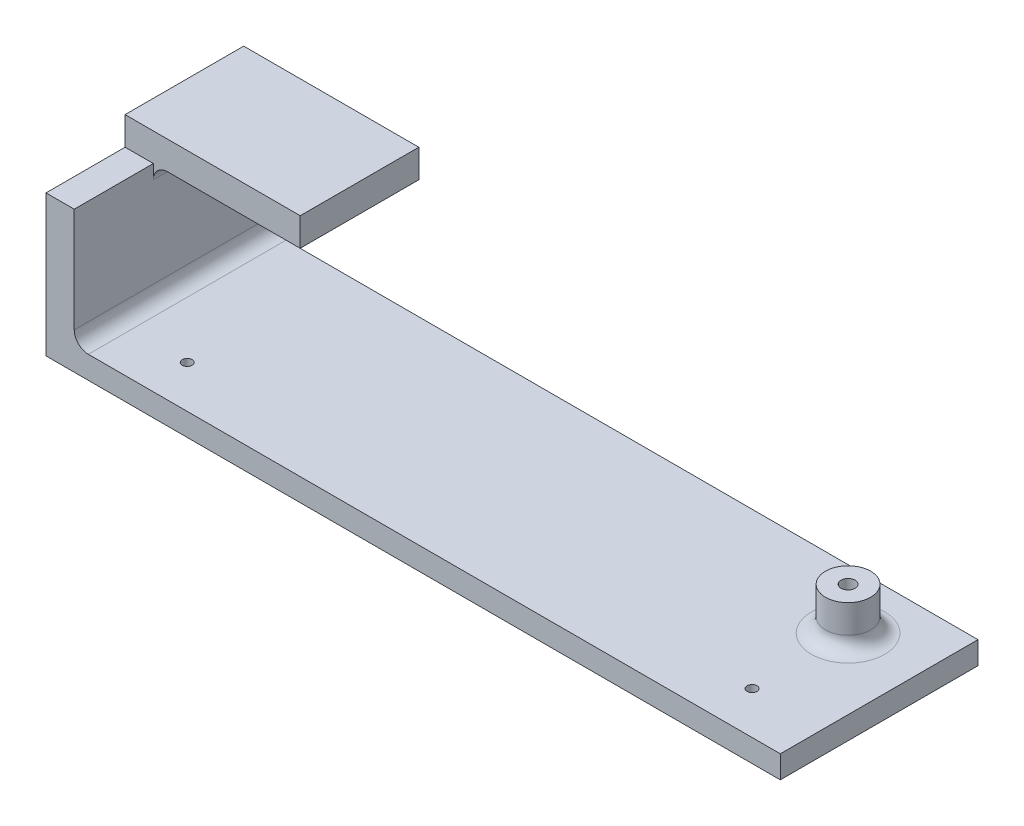
from build123d import *

# Parameters (mm, degrees)
SKETCH_1_W          = 250
SKETCH_1_H          = 70
EXTRUDE_1_DEPTH     = 8
SKETCH_2_R          = 1.75
CUT_EXTRUDE_1_DEPTH = 8
SKETCH_3_W          = 10
SKETCH_3_H          = 70
EXTRUDE_2_DEPTH     = 50
SKETCH_4_W          = 42
SKETCH_4_H          = 10
EXTRUDE_3_DEPTH     = 62
FILLET_2_R          = 5
SKETCH_6_R          = 8
SKETCH_6_R_2        = 2.5
EXTRUDE_4_DEPTH     = 15
FILLET_3_R          = 5


with BuildPart() as part:
    # 草图1 → 凸台-拉伸1 (new body)
    with BuildSketch(Plane(origin=(0, 0, 0), x_dir=(1, 0, 0), z_dir=(0, 1, 0))):
        with Locations((125, 35)):
            Rectangle(SKETCH_1_W, SKETCH_1_H)
    extrude(amount=EXTRUDE_1_DEPTH)

    # 草图2 → 切除-拉伸1 (cut)
    with BuildSketch(Plane(origin=(0, 8, 0), x_dir=(1, 0, 0), z_dir=(0, 1, 0))):
        with Locations(Location((25, 15, 0), (0, 0, 270))):
            Circle(SKETCH_2_R)
        with Locations(Location((225, 15, 0), (0, 0, 270))):
            Circle(SKETCH_2_R)
    extrude(amount=-CUT_EXTRUDE_1_DEPTH, mode=Mode.SUBTRACT)

    # 草图3 → 凸台-拉伸2 (add)
    with BuildSketch(Plane.XZ):
        with Locations((-5, -35)):
            Rectangle(SKETCH_3_W, SKETCH_3_H)
    extrude(amount=-EXTRUDE_2_DEPTH)

    # 草图4 → 凸台-拉伸3 (add)
    with BuildSketch(Plane.ZY.offset(10)):
        with Locations((-49, 55)):
            Rectangle(SKETCH_4_W, SKETCH_4_H)
    extrude(amount=-EXTRUDE_3_DEPTH)

    # 圆角2
    fillet_2_edges = [part.edges().sort_by_distance(p)[0] for p in [
        (0, 50, -49),
        (0, 8, -35),
    ]]
    fillet(fillet_2_edges, radius=FILLET_2_R)

    # 草图6 → 凸台-拉伸4 (add)
    with BuildSketch(Plane(origin=(0, 8, 0), x_dir=(1, 0, 0), z_dir=(0, 1, 0))):
        with Locations(Location((225, 49, 0), (0, 0, 90))):
            Circle(SKETCH_6_R)
        with Locations(Location((225, 49, 0), (0, 0, 270))):
            Circle(SKETCH_6_R_2, mode=Mode.SUBTRACT)
    extrude(amount=EXTRUDE_4_DEPTH)

    # 圆角3
    fillet_3_edges = [part.edges().sort_by_distance(p)[0] for p in [
        (225, 8, -41),
    ]]
    fillet(fillet_3_edges, radius=FILLET_3_R)


solid = part.part
